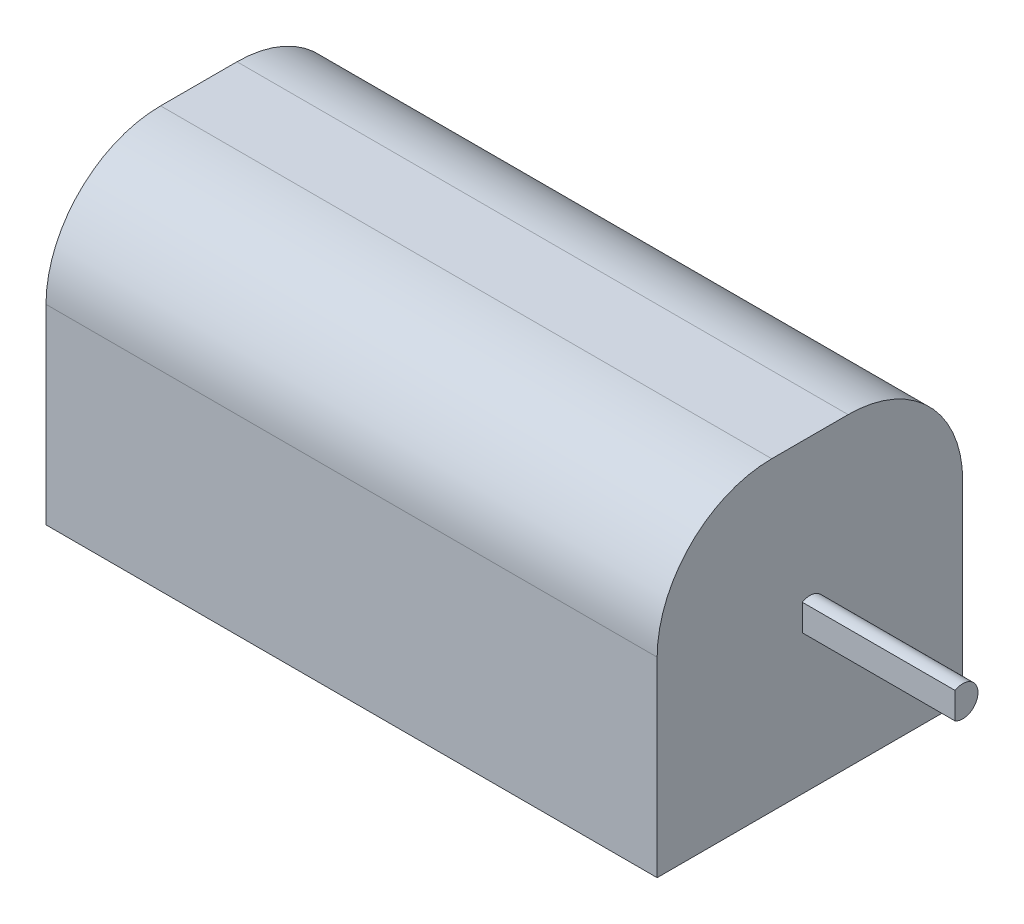
from build123d import *

# Parameters (mm, degrees)
SKETCH1_W           = 80
SKETCH1_H           = 40
BOSS_EXTRUDE1_DEPTH = 20
BOSS_EXTRUDE2_START = 40
BOSS_EXTRUDE2_DEPTH = 20
FILLET1_R           = 15


with BuildPart() as part:
    # Sketch1 → Boss-Extrude1 (new, symmetric)
    with BuildSketch(Plane(origin=(0, 0, 0), x_dir=(1, 0, 0), z_dir=(0, 1, 0))):
        Rectangle(SKETCH1_W, SKETCH1_H)
    extrude(amount=BOSS_EXTRUDE1_DEPTH, both=True)

    # Sketch4 → Boss-Extrude2 (add)
    with BuildSketch(Plane(origin=(0, 0, 0), x_dir=(0, 0, -1), z_dir=(1, 0, 0)).offset(BOSS_EXTRUDE2_START)):
        with BuildLine():
            ThreePointArc((2, 0), (1, 1.732050808), (-1, 1.732050808))
            Line((-1, 1.732050808), (-1, -1.732050808))
            ThreePointArc((-1, -1.732050808), (1, -1.732050808), (2, 0))
        make_face()
    extrude(amount=BOSS_EXTRUDE2_DEPTH)

    # Fillet1
    fillet1_edges = [part.edges().sort_by_distance(p)[0] for p in [
        (0, 20, 20),
        (0, 20, -20),
    ]]
    fillet(fillet1_edges, radius=FILLET1_R)


solid = part.part
